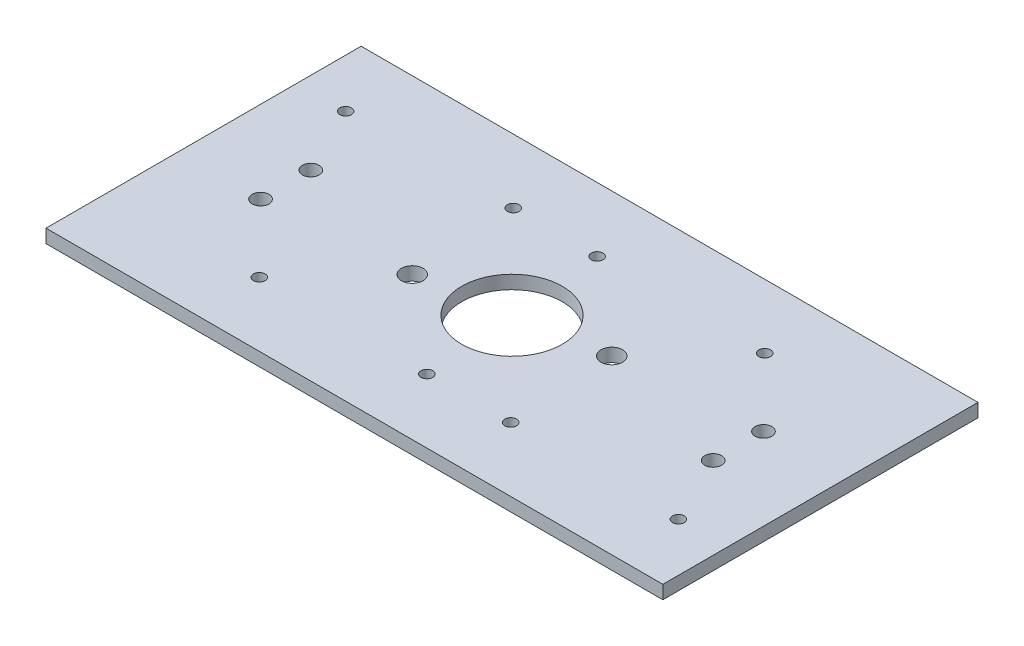
from build123d import *

# Parameters (mm, degrees)
SKETCH1_W           = 184
SKETCH1_H           = 94
SKETCH1_R           = 15
SKETCH1_R_2         = 1.75
SKETCH1_R_3         = 3.225
SKETCH1_R_4         = 2.5
BOSS_EXTRUDE1_DEPTH = 4


with BuildPart() as part:
    # Sketch1 → Boss-Extrude1 (new body)
    with BuildSketch(Plane(origin=(0, 0, 0), x_dir=(1, 0, 0), z_dir=(0, 1, 0))):
        Rectangle(SKETCH1_W, SKETCH1_H)
        with Locations(Location((0, 0, 0), (0, 0, 270))):
            Circle(SKETCH1_R, mode=Mode.SUBTRACT)
        with Locations(Location((-2.5, 27.88, 0), (0, 0, 270))):
            Circle(SKETCH1_R_2, mode=Mode.SUBTRACT)
        with Locations(Location((-27.5, 27.88, 0), (0, 0, 270))):
            Circle(SKETCH1_R_2, mode=Mode.SUBTRACT)
        with Locations(Location((47.5, 27.88, 0), (0, 0, 270))):
            Circle(SKETCH1_R_2, mode=Mode.SUBTRACT)
        with Locations(Location((-77.5, 27.88, 0), (0, 0, 270))):
            Circle(SKETCH1_R_2, mode=Mode.SUBTRACT)
        with Locations(Location((25.4, 4.36, 0), (0, 0, 270))):
            Circle(SKETCH1_R_3, mode=Mode.SUBTRACT)
        with Locations(Location((-67.5, 7.5, 0), (0, 0, 270))):
            Circle(SKETCH1_R_4, mode=Mode.SUBTRACT)
        with Locations(Location((67.5, 7.5, 0), (0, 0, 270))):
            Circle(SKETCH1_R_4, mode=Mode.SUBTRACT)
        with Locations(Location((77.5, -27.88, 0), (0, 0, 270))):
            Circle(SKETCH1_R_2, mode=Mode.SUBTRACT)
        with Locations(Location((27.5, -27.88, 0), (0, 0, 270))):
            Circle(SKETCH1_R_2, mode=Mode.SUBTRACT)
        with Locations(Location((2.5, -27.88, 0), (0, 0, 270))):
            Circle(SKETCH1_R_2, mode=Mode.SUBTRACT)
        with Locations(Location((-47.5, -27.88, 0), (0, 0, 270))):
            Circle(SKETCH1_R_2, mode=Mode.SUBTRACT)
        with Locations(Location((-25.4, -4.36, 0), (0, 0, 270))):
            Circle(SKETCH1_R_3, mode=Mode.SUBTRACT)
        with Locations(Location((-67.5, -7.5, 0), (0, 0, 270))):
            Circle(SKETCH1_R_4, mode=Mode.SUBTRACT)
        with Locations(Location((67.5, -7.5, 0), (0, 0, 270))):
            Circle(SKETCH1_R_4, mode=Mode.SUBTRACT)
    extrude(amount=BOSS_EXTRUDE1_DEPTH)


solid = part.part
